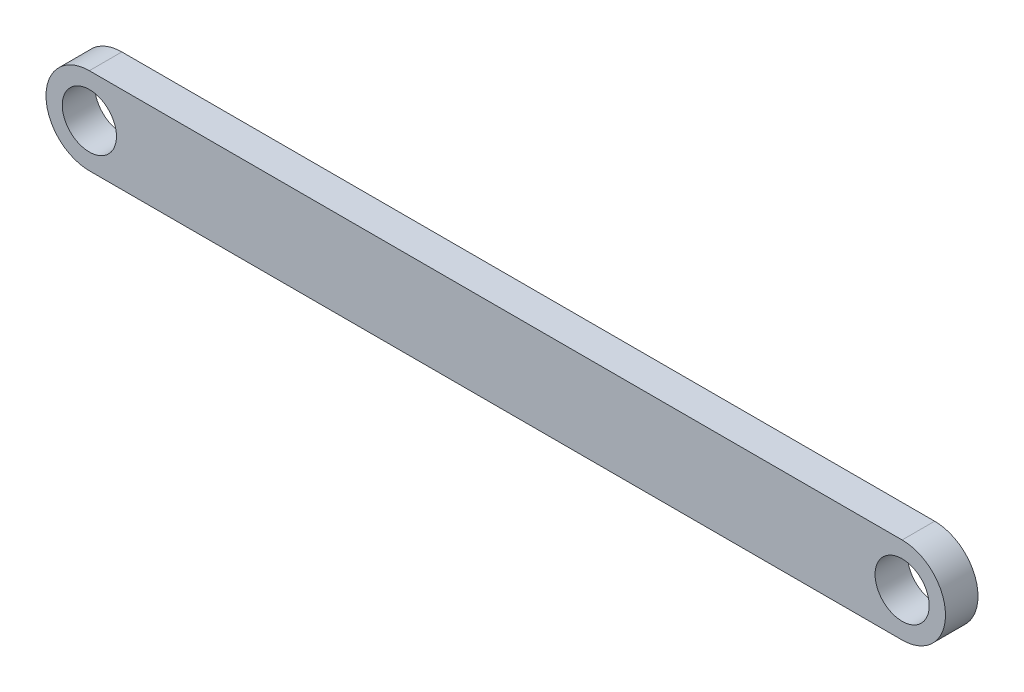
from build123d import *

# Parameters (mm, degrees)
SKETCH1_R           = 2.5
BOSS_EXTRUDE1_DEPTH = 3


with BuildPart() as part:
    # Sketch1 → Boss-Extrude1 (new body)
    with BuildSketch(Plane(origin=(0, 34.703080777, 0), x_dir=(1, 0, 0), z_dir=(0, 0, 1))):
        with BuildLine():
            Line((-30.372366657, 17.432635687), (44.627633343, 17.432635687))
            ThreePointArc((44.627633343, 17.432635687), (48.627633343, 13.432635687), (44.627633343, 9.432635687))
            Line((44.627633343, 9.432635687), (-30.372366657, 9.432635687))
            ThreePointArc((-30.372366657, 9.432635687), (-34.372366657, 13.432635687), (-30.372366657, 17.432635687))
        make_face()
        with Locations((-30.372366657, 13.432635687)):
            Circle(SKETCH1_R, mode=Mode.SUBTRACT)
        with Locations((44.627633343, 13.432635687)):
            Circle(SKETCH1_R, mode=Mode.SUBTRACT)
    extrude(amount=BOSS_EXTRUDE1_DEPTH)


solid = part.part
